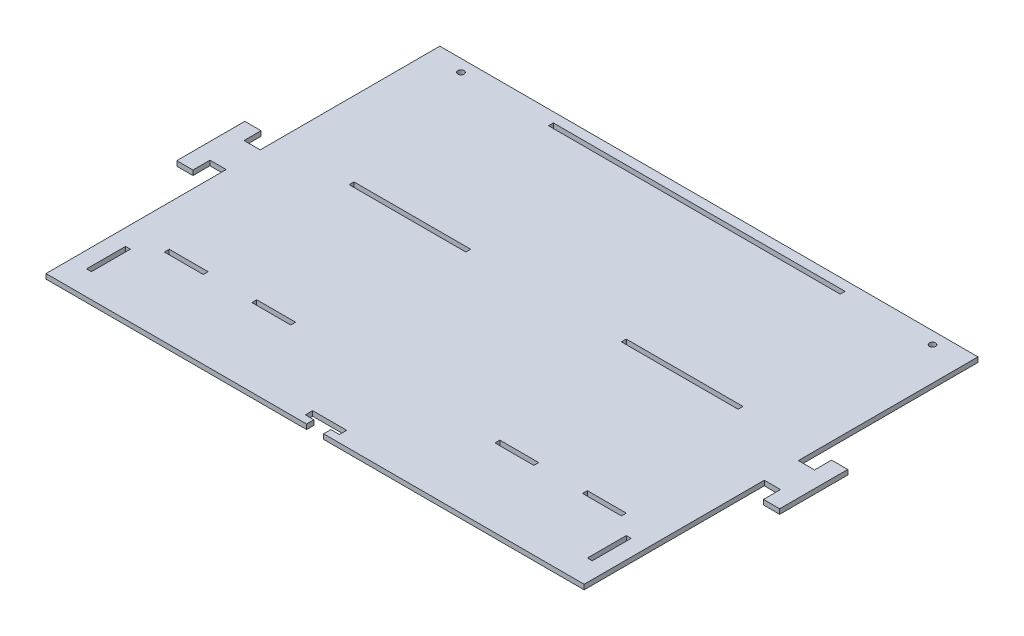
from build123d import *

# Parameters (mm, degrees)
CROQUIS1_W              = 1660
CROQUIS1_H              = 810
CROQUIS1_W_2            = 300
CROQUIS1_H_2            = 5
SALIENTE_EXTRUIR3_DEPTH = 5
CROQUIS2_W              = 5
CROQUIS2_H              = 40
CROQUIS2_W_2            = 30
CROQUIS2_H_2            = 5
CROQUIS2_W_3            = 120
CROQUIS2_W_4            = 32.5
CROQUIS2_H_3            = 45
CROQUIS2_W_5            = 40
CORTAR_EXTRUIR2_DEPTH   = 10
CROQUIS3_R              = 3.2
CORTAR_EXTRUIR3_DEPTH   = 10
CORTAR_EXTRUIR5_DEPTH   = 10


with BuildPart() as part:
    # Croquis1 → Saliente-Extruir3 (new body)
    with BuildSketch(Plane(origin=(0, 0, 0), x_dir=(1, 0, 0), z_dir=(0, 1, 0))):
        with Locations((-1267.044657187, -398.10267676)):
            Rectangle(CROQUIS1_W, CROQUIS1_H)
        Polygon((-447.044657187, -95.60267676), (-447.044657187, -240.60267676), (-452.044657187, -240.60267676), (-452.044657187, -95.60267676), (-452.044657187, -90.60267676), (-447.044657187, -90.60267676), align=None, mode=Mode.SUBTRACT)
        with Locations((-782.044657187, -5.60267676)):
            Rectangle(CROQUIS1_W_2, CROQUIS1_H_2, mode=Mode.SUBTRACT)
        with Locations((-1267.044657187, -5.60267676)):
            Rectangle(CROQUIS1_W_2, CROQUIS1_H_2, mode=Mode.SUBTRACT)
        with Locations((-1752.044657187, -5.60267676)):
            Rectangle(CROQUIS1_W_2, CROQUIS1_H_2, mode=Mode.SUBTRACT)
        Polygon((-452.044657187, -328.10267676), (-452.044657187, -473.10267676), (-447.044657187, -473.10267676), (-447.044657187, -328.10267676), (-447.044657187, -323.10267676), (-452.044657187, -323.10267676), align=None, mode=Mode.SUBTRACT)
        Polygon((-452.044657187, -560.60267676), (-452.044657187, -705.60267676), (-447.044657187, -705.60267676), (-447.044657187, -560.60267676), (-447.044657187, -555.60267676), (-452.044657187, -555.60267676), align=None, mode=Mode.SUBTRACT)
        Polygon((-2087.044657187, -705.60267676), (-2082.044657187, -705.60267676), (-2082.044657187, -560.60267676), (-2082.044657187, -555.60267676), (-2087.044657187, -555.60267676), (-2087.044657187, -560.60267676), align=None, mode=Mode.SUBTRACT)
        Polygon((-2087.044657187, -473.10267676), (-2082.044657187, -473.10267676), (-2082.044657187, -328.10267676), (-2082.044657187, -323.10267676), (-2087.044657187, -323.10267676), (-2087.044657187, -328.10267676), align=None, mode=Mode.SUBTRACT)
        Polygon((-2087.044657187, -240.60267676), (-2082.044657187, -240.60267676), (-2082.044657187, -95.60267676), (-2082.044657187, -90.60267676), (-2087.044657187, -90.60267676), (-2087.044657187, -95.60267676), align=None, mode=Mode.SUBTRACT)
        with Locations((-1267.044657187, -790.60267676)):
            Rectangle(CROQUIS1_W_2, CROQUIS1_H_2, mode=Mode.SUBTRACT)
        with Locations((-782.044657187, -790.60267676)):
            Rectangle(CROQUIS1_W_2, CROQUIS1_H_2, mode=Mode.SUBTRACT)
        with Locations((-1752.044657187, -790.60267676)):
            Rectangle(CROQUIS1_W_2, CROQUIS1_H_2, mode=Mode.SUBTRACT)
    extrude(amount=SALIENTE_EXTRUIR3_DEPTH)

    # Croquis2 → Cortar-Extruir2 (cut)
    with BuildSketch(Plane(origin=(0, 5, 0), x_dir=(1, 0, 0), z_dir=(0, 1, 0))):
        with Locations((-1009.544657188, -443.10267676)):
            Rectangle(CROQUIS2_W, CROQUIS2_H)
        with Locations((-684.544657187, -635.60267676)):
            Rectangle(CROQUIS2_W_2, CROQUIS2_H_2)
        with Locations((-1127.044657187, -635.60267676)):
            Rectangle(CROQUIS2_W_3, CROQUIS2_H_2)
        with Locations((-1407.044657187, -635.60267676)):
            Rectangle(CROQUIS2_W_3, CROQUIS2_H_2)
        with Locations((-629.544657187, -635.60267676)):
            Rectangle(CROQUIS2_W_2, CROQUIS2_H_2)
        with Locations((-1404.544657188, -480.60267676)):
            Rectangle(CROQUIS2_W_3, CROQUIS2_H_2)
        with Locations((-785.794657187, -480.60267676)):
            Rectangle(CROQUIS2_W_4, CROQUIS2_H_2)
        with Locations((-833.294657187, -480.60267676)):
            Rectangle(CROQUIS2_W_4, CROQUIS2_H_2)
        with Locations((-604.544657187, -513.10267676)):
            Rectangle(CROQUIS2_W, CROQUIS2_H_3)
        with Locations((-864.544657187, -675.60267676)):
            Rectangle(CROQUIS2_W, CROQUIS2_H_3)
        with Locations((-1052.044657188, -315.60267676)):
            Rectangle(CROQUIS2_W_5, CROQUIS2_H_2)
        with Locations((-1142.044657188, -315.60267676)):
            Rectangle(CROQUIS2_W_5, CROQUIS2_H_2)
        with Locations((-1009.544657188, -353.10267676)):
            Rectangle(CROQUIS2_W, CROQUIS2_H)
        with Locations((-1124.544657188, -480.60267676)):
            Rectangle(CROQUIS2_W_3, CROQUIS2_H_2)
        with Locations((-604.544657187, -593.10267676)):
            Rectangle(CROQUIS2_W, CROQUIS2_H_3)
        with Locations((-1127.044657187, -160.60267676)):
            Rectangle(CROQUIS2_W_3, CROQUIS2_H_2)
        with Locations((-1407.044657187, -160.60267676)):
            Rectangle(CROQUIS2_W_3, CROQUIS2_H_2)
        with Locations((-864.544657187, -750.60267676)):
            Rectangle(CROQUIS2_W, CROQUIS2_H_3)
        with Locations((-1392.044657187, -315.60267676)):
            Rectangle(CROQUIS2_W_5, CROQUIS2_H_2)
        with Locations((-1929.544657187, -283.10267676)):
            Rectangle(CROQUIS2_W, CROQUIS2_H_3)
        with Locations((-1482.044657187, -315.60267676)):
            Rectangle(CROQUIS2_W_5, CROQUIS2_H_2)
        with Locations((-1700.794657187, -480.60267676)):
            Rectangle(CROQUIS2_W_4, CROQUIS2_H_2)
        with Locations((-1748.294657187, -480.60267676)):
            Rectangle(CROQUIS2_W_4, CROQUIS2_H_2)
        with Locations((-1929.544657187, -513.10267676)):
            Rectangle(CROQUIS2_W, CROQUIS2_H_3)
        with Locations((-1669.544657187, -750.60267676)):
            Rectangle(CROQUIS2_W, CROQUIS2_H_3)
        with Locations((-1524.544657187, -353.10267676)):
            Rectangle(CROQUIS2_W, CROQUIS2_H)
        with Locations((-1524.544657187, -443.10267676)):
            Rectangle(CROQUIS2_W, CROQUIS2_H)
        with Locations((-1669.544657187, -675.60267676)):
            Rectangle(CROQUIS2_W, CROQUIS2_H_3)
        with Locations((-1904.544657187, -635.60267676)):
            Rectangle(CROQUIS2_W_2, CROQUIS2_H_2)
        with Locations((-1929.544657187, -593.10267676)):
            Rectangle(CROQUIS2_W, CROQUIS2_H_3)
        with Locations((-1849.544657187, -635.60267676)):
            Rectangle(CROQUIS2_W_2, CROQUIS2_H_2)
        with Locations((-604.544657187, -283.10267676)):
            Rectangle(CROQUIS2_W, CROQUIS2_H_3)
        with Locations((-833.294657187, -315.60267676)):
            Rectangle(CROQUIS2_W_4, CROQUIS2_H_2)
        with Locations((-785.794657187, -315.60267676)):
            Rectangle(CROQUIS2_W_4, CROQUIS2_H_2)
        with Locations((-864.544657187, -45.60267676)):
            Rectangle(CROQUIS2_W, CROQUIS2_H_3)
        with Locations((-864.544657187, -120.60267676)):
            Rectangle(CROQUIS2_W, CROQUIS2_H_3)
        with Locations((-629.544657187, -160.60267676)):
            Rectangle(CROQUIS2_W_2, CROQUIS2_H_2)
        with Locations((-604.544657187, -203.10267676)):
            Rectangle(CROQUIS2_W, CROQUIS2_H_3)
        with Locations((-684.544657187, -160.60267676)):
            Rectangle(CROQUIS2_W_2, CROQUIS2_H_2)
        with Locations((-1849.544657187, -160.60267676)):
            Rectangle(CROQUIS2_W_2, CROQUIS2_H_2)
        with Locations((-1904.544657187, -160.60267676)):
            Rectangle(CROQUIS2_W_2, CROQUIS2_H_2)
        with Locations((-1669.544657187, -120.60267676)):
            Rectangle(CROQUIS2_W, CROQUIS2_H_3)
        with Locations((-1929.544657187, -203.10267676)):
            Rectangle(CROQUIS2_W, CROQUIS2_H_3)
        with Locations((-1669.544657187, -45.60267676)):
            Rectangle(CROQUIS2_W, CROQUIS2_H_3)
        with Locations((-1748.294657187, -315.60267676)):
            Rectangle(CROQUIS2_W_4, CROQUIS2_H_2)
        with Locations((-1700.794657187, -315.60267676)):
            Rectangle(CROQUIS2_W_4, CROQUIS2_H_2)
    extrude(amount=-CORTAR_EXTRUIR2_DEPTH, mode=Mode.SUBTRACT)

    # Croquis3 → Cortar-Extruir3 (cut)
    with BuildSketch(Plane(origin=(0, 5, 0), x_dir=(1, 0, 0), z_dir=(0, 1, 0))):
        with Locations(Location((-2084.544657187, -281.85267676, 0), (0, 0, 270))):
            Circle(CROQUIS3_R)
        with Locations(Location((-2084.544657187, -514.35267676, 0), (0, 0, 270))):
            Circle(CROQUIS3_R)
        with Locations(Location((-1509.544657187, -790.60267676, 0), (0, 0, 270))):
            Circle(CROQUIS3_R)
        with Locations(Location((-1024.544657187, -790.60267676, 0), (0, 0, 270))):
            Circle(CROQUIS3_R)
        with Locations(Location((-449.544657187, -514.35267676, 0), (0, 0, 270))):
            Circle(CROQUIS3_R)
        with Locations(Location((-449.544657187, -281.85267676, 0), (0, 0, 270))):
            Circle(CROQUIS3_R)
        with Locations(Location((-1024.544657187, -5.60267676, 0), (0, 0, 270))):
            Circle(CROQUIS3_R)
        with Locations(Location((-1509.544657187, -5.60267676, 0), (0, 0, 270))):
            Circle(CROQUIS3_R)
    extrude(amount=-CORTAR_EXTRUIR3_DEPTH, mode=Mode.SUBTRACT)

    # Croquis5 → Cortar-Extruir5 (cut)
    with BuildSketch(Plane(origin=(0, 5, 0), x_dir=(1, 0, 0), z_dir=(0, 1, 0))):
        Polygon((-1560.394657187, -177.84196813), (-1543.744657187, -177.84196813), (-1543.744657187, -160.34196813), (-1543.744657187, 6.89732324), (-2097.044657187, 6.89732324), (-2097.044657187, -803.10267676), (-437.044657187, -803.10267676), (-437.044657187, 6.89732324), (-990.344657187, 6.89732324), (-990.344657187, -160.34196813), (-990.344657187, -177.84196813), (-973.694657187, -177.84196813), (-973.694657187, -160.34196813), (-957.044657187, -160.34196813), (-957.044657187, -230.34196813), (-973.694657187, -230.34196813), (-973.694657187, -212.84196813), (-990.344657187, -212.84196813), (-990.344657187, -230.34196813), (-990.344657187, -398.10267676), (-1258.294657187, -398.10267676), (-1258.294657187, -390.60267676), (-1249.544657187, -390.60267676), (-1249.544657187, -383.10267676), (-1284.544657187, -383.10267676), (-1284.544657187, -390.60267676), (-1275.794657187, -390.60267676), (-1275.794657187, -398.10267676), (-1543.744657187, -398.10267676), (-1543.744657187, -230.34196813), (-1543.744657187, -212.84196813), (-1560.394657187, -212.84196813), (-1560.394657187, -230.34196813), (-1577.044657187, -230.34196813), (-1577.044657187, -160.34196813), (-1560.394657187, -160.34196813), align=None)
    extrude(amount=-CORTAR_EXTRUIR5_DEPTH, mode=Mode.SUBTRACT)


solid = part.part
